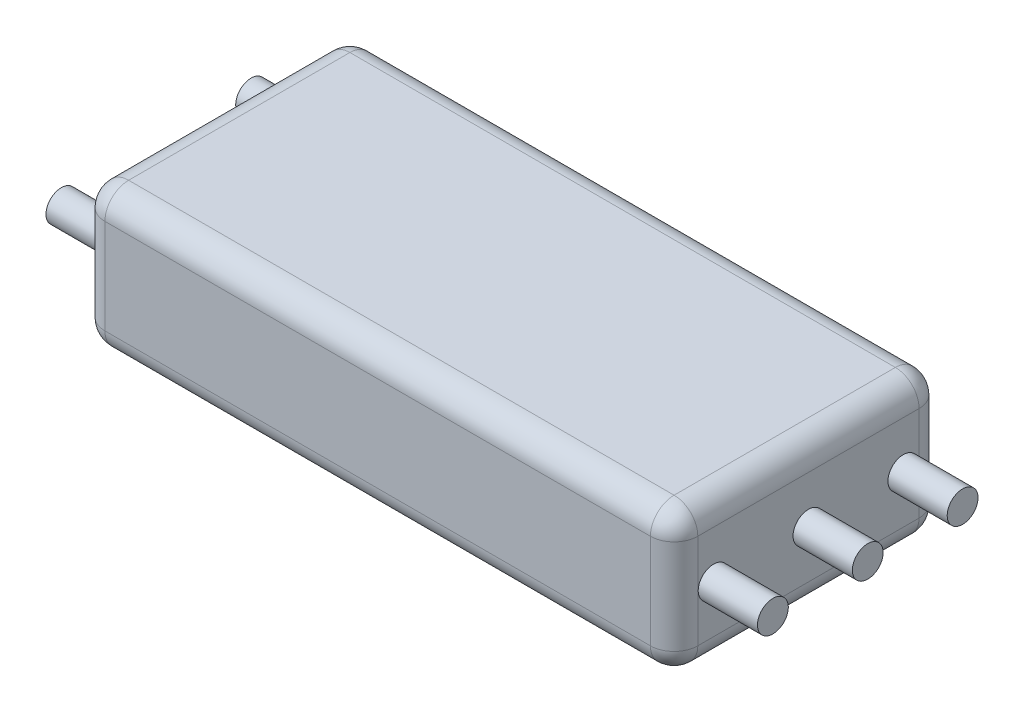
from build123d import *

# Parameters (mm, degrees)
SKETCH1_W           = 63.5
SKETCH1_H           = 28.7782
BOSS_EXTRUDE1_DEPTH = 7.62
FILLET1_R           = 2.54
BOSS_EXTRUDE2_START = 31.75
SKETCH2_R           = 1.651
BOSS_EXTRUDE2_DEPTH = 6.35
BOSS_EXTRUDE3_START = -38.1
SKETCH2_2_R         = 1.651
BOSS_EXTRUDE3_DEPTH = 6.35


with BuildPart() as part:
    # Sketch1 → Boss-Extrude1 (new, symmetric)
    with BuildSketch(Plane(origin=(0, 0, 0), x_dir=(1, 0, 0), z_dir=(0, 1, 0))):
        Rectangle(SKETCH1_W, SKETCH1_H)
    extrude(amount=BOSS_EXTRUDE1_DEPTH, both=True)

    # Fillet1
    fillet1_edges = [part.edges().sort_by_distance(p)[0] for p in [
        (-31.75, 7.62, 0),
        (0, 7.62, 14.3891),
        (31.75, 7.62, 0),
        (0, -7.62, 14.3891),
        (-31.75, -7.62, 0),
        (0, -7.62, -14.3891),
        (31.75, -7.62, 0),
        (31.75, 0, 14.3891),
        (-31.75, 0, 14.3891),
        (-31.75, 0, -14.3891),
        (31.75, 0, -14.3891),
        (0, 7.62, -14.3891),
    ]]
    fillet(fillet1_edges, radius=FILLET1_R)

    # Sketch2 → Boss-Extrude2 (add)
    with BuildSketch(Plane(origin=(0, 0, 0), x_dir=(0, 0, -1), z_dir=(1, 0, 0)).offset(BOSS_EXTRUDE2_START)):
        with Locations(Location((0, 0, 0), (0, 0, 180))):
            Circle(SKETCH2_R)
        with Locations(Location((10.16, 0, 0), (0, 0, 180))):
            Circle(SKETCH2_R)
        with Locations(Location((-10.16, 0, 0), (0, 0, 180))):
            Circle(SKETCH2_R)
    extrude(amount=BOSS_EXTRUDE2_DEPTH)

    # Sketch2<2> → Boss-Extrude3 (add)
    with BuildSketch(Plane(origin=(0, 0, 0), x_dir=(0, 0, -1), z_dir=(1, 0, 0)).offset(BOSS_EXTRUDE3_START)):
        with Locations(Location((10.16, 0, 0), (0, 0, 180))):
            Circle(SKETCH2_2_R)
        with Locations(Location((-10.16, 0, 0), (0, 0, 180))):
            Circle(SKETCH2_2_R)
    extrude(amount=BOSS_EXTRUDE3_DEPTH)


solid = part.part
